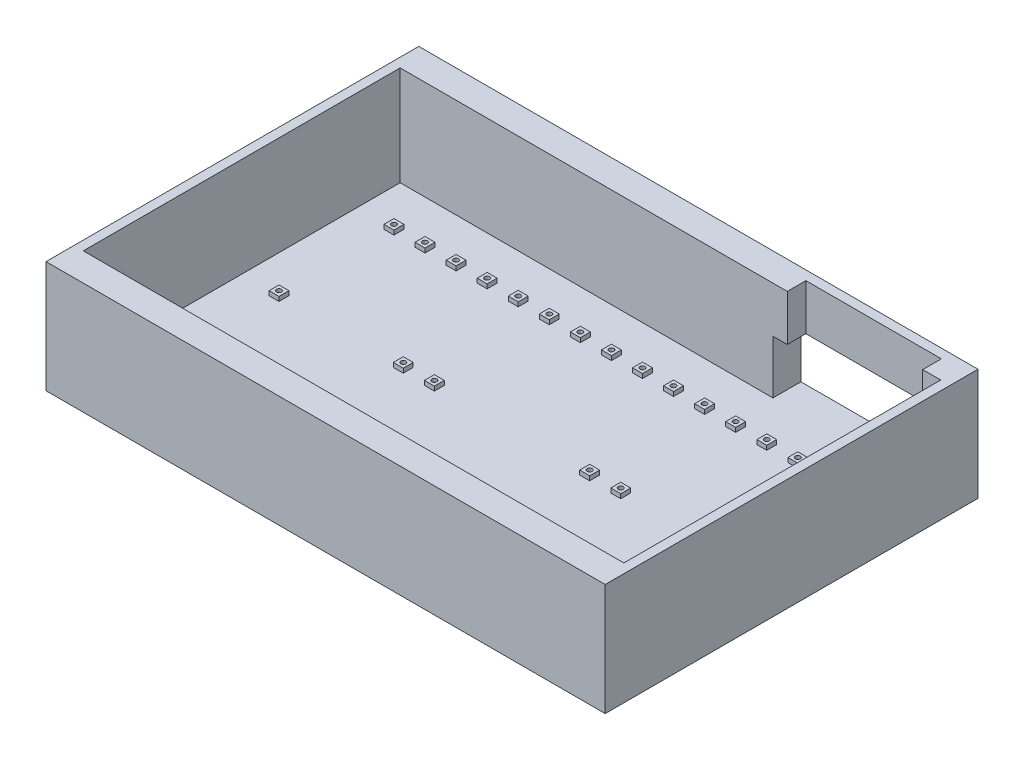
from build123d import *

# Parameters (mm, degrees)
SKETCH1_W           = 450
SKETCH1_H           = 300
BOSS_EXTRUDE1_DEPTH = 90
SKETCH2_W           = 435
SKETCH2_H           = 255
CUT_EXTRUDE1_DEPTH  = 80
SKETCH3_W           = 8
SKETCH3_H           = 8
SKETCH3_R           = 2
BOSS_EXTRUDE2_DEPTH = 3.5
SKETCH5_W           = 109
SKETCH5_H           = 15
CUT_EXTRUDE2_DEPTH  = 80
SKETCH7_W           = 135
SKETCH7_H           = 43
CUT_EXTRUDE3_DEPTH  = 369.417222724


with BuildPart() as part:
    # Sketch1 → Boss-Extrude1 (new body)
    with BuildSketch(Plane(origin=(0, 0, 0), x_dir=(1, 0, 0), z_dir=(0, 1, 0))):
        Rectangle(SKETCH1_W, SKETCH1_H)
    extrude(amount=BOSS_EXTRUDE1_DEPTH)

    # Sketch2 → Cut-Extrude1 (cut)
    with BuildSketch(Plane(origin=(0, 90, 0), x_dir=(1, 0, 0), z_dir=(0, 1, 0))):
        Rectangle(SKETCH2_W, SKETCH2_H)
    extrude(amount=-CUT_EXTRUDE1_DEPTH, mode=Mode.SUBTRACT)

    # Sketch3 → Boss-Extrude2 (add)
    # profile 1 of 38: a face of its own
    with BuildSketch(Plane(origin=(0, 10, 0), x_dir=(1, 0, 0), z_dir=(0, 1, 0))):
        with Locations((-162.5, 92.5)):
            Rectangle(SKETCH3_W, SKETCH3_H)
        with Locations(Location((-162.5, 92.5, 0), (0, 0, 270))):
            Circle(SKETCH3_R, mode=Mode.SUBTRACT)
    # profile 2 of 38: a face of its own
    with BuildSketch(Plane(origin=(0, 10, 0), x_dir=(1, 0, 0), z_dir=(0, 1, 0))):
        with Locations((-187.5, 92.5)):
            Rectangle(SKETCH3_W, SKETCH3_H)
        with Locations(Location((-187.5, 92.5, 0), (0, 0, 270))):
            Circle(SKETCH3_R, mode=Mode.SUBTRACT)
    # profile 3 of 38: a face of its own
    with BuildSketch(Plane(origin=(0, 10, 0), x_dir=(1, 0, 0), z_dir=(0, 1, 0))):
        with Locations((-137.5, 92.5)):
            Rectangle(SKETCH3_W, SKETCH3_H)
        with Locations(Location((-137.5, 92.5, 0), (0, 0, 270))):
            Circle(SKETCH3_R, mode=Mode.SUBTRACT)
    # profile 4 of 38: a face of its own
    with BuildSketch(Plane(origin=(0, 10, 0), x_dir=(1, 0, 0), z_dir=(0, 1, 0))):
        with Locations((-112.5, 92.5)):
            Rectangle(SKETCH3_W, SKETCH3_H)
        with Locations(Location((-112.5, 92.5, 0), (0, 0, 270))):
            Circle(SKETCH3_R, mode=Mode.SUBTRACT)
    # profile 5 of 38: a face of its own
    with BuildSketch(Plane(origin=(0, 10, 0), x_dir=(1, 0, 0), z_dir=(0, 1, 0))):
        with Locations((-87.5, 92.5)):
            Rectangle(SKETCH3_W, SKETCH3_H)
        with Locations(Location((-87.5, 92.5, 0), (0, 0, 270))):
            Circle(SKETCH3_R, mode=Mode.SUBTRACT)
    # profile 6 of 38: a face of its own
    with BuildSketch(Plane(origin=(0, 10, 0), x_dir=(1, 0, 0), z_dir=(0, 1, 0))):
        with Locations((-62.5, 92.5)):
            Rectangle(SKETCH3_W, SKETCH3_H)
        with Locations(Location((-62.5, 92.5, 0), (0, 0, 270))):
            Circle(SKETCH3_R, mode=Mode.SUBTRACT)
    # profile 7 of 38: a face of its own
    with BuildSketch(Plane(origin=(0, 10, 0), x_dir=(1, 0, 0), z_dir=(0, 1, 0))):
        with Locations((-37.5, 92.5)):
            Rectangle(SKETCH3_W, SKETCH3_H)
        with Locations(Location((-37.5, 92.5, 0), (0, 0, 270))):
            Circle(SKETCH3_R, mode=Mode.SUBTRACT)
    # profile 8 of 38: a face of its own
    with BuildSketch(Plane(origin=(0, 10, 0), x_dir=(1, 0, 0), z_dir=(0, 1, 0))):
        with Locations((-12.5, 92.5)):
            Rectangle(SKETCH3_W, SKETCH3_H)
        with Locations(Location((-12.5, 92.5, 0), (0, 0, 270))):
            Circle(SKETCH3_R, mode=Mode.SUBTRACT)
    # profile 9 of 38: a face of its own
    with BuildSketch(Plane(origin=(0, 10, 0), x_dir=(1, 0, 0), z_dir=(0, 1, 0))):
        with Locations((12.5, 92.5)):
            Rectangle(SKETCH3_W, SKETCH3_H)
        with Locations(Location((12.5, 92.5, 0), (0, 0, 270))):
            Circle(SKETCH3_R, mode=Mode.SUBTRACT)
    # profile 10 of 38: a face of its own
    with BuildSketch(Plane(origin=(0, 10, 0), x_dir=(1, 0, 0), z_dir=(0, 1, 0))):
        with Locations((37.5, 92.5)):
            Rectangle(SKETCH3_W, SKETCH3_H)
        with Locations(Location((37.5, 92.5, 0), (0, 0, 270))):
            Circle(SKETCH3_R, mode=Mode.SUBTRACT)
    # profile 11 of 38: a face of its own
    with BuildSketch(Plane(origin=(0, 10, 0), x_dir=(1, 0, 0), z_dir=(0, 1, 0))):
        with Locations((62.5, 92.5)):
            Rectangle(SKETCH3_W, SKETCH3_H)
        with Locations(Location((62.5, 92.5, 0), (0, 0, 270))):
            Circle(SKETCH3_R, mode=Mode.SUBTRACT)
    # profile 12 of 38: a face of its own
    with BuildSketch(Plane(origin=(0, 10, 0), x_dir=(1, 0, 0), z_dir=(0, 1, 0))):
        with Locations((87.5, 92.5)):
            Rectangle(SKETCH3_W, SKETCH3_H)
        with Locations(Location((87.5, 92.5, 0), (0, 0, 270))):
            Circle(SKETCH3_R, mode=Mode.SUBTRACT)
    # profile 13 of 38: a face of its own
    with BuildSketch(Plane(origin=(0, 10, 0), x_dir=(1, 0, 0), z_dir=(0, 1, 0))):
        with Locations((112.5, 92.5)):
            Rectangle(SKETCH3_W, SKETCH3_H)
        with Locations(Location((112.5, 92.5, 0), (0, 0, 270))):
            Circle(SKETCH3_R, mode=Mode.SUBTRACT)
    # profile 14 of 38: a face of its own
    with BuildSketch(Plane(origin=(0, 10, 0), x_dir=(1, 0, 0), z_dir=(0, 1, 0))):
        with Locations((137.5, 92.5)):
            Rectangle(SKETCH3_W, SKETCH3_H)
        with Locations(Location((137.5, 92.5, 0), (0, 0, 270))):
            Circle(SKETCH3_R, mode=Mode.SUBTRACT)
    # profile 15 of 38: a face of its own
    with BuildSketch(Plane(origin=(0, 10, 0), x_dir=(1, 0, 0), z_dir=(0, 1, 0))):
        with Locations((162.5, 92.5)):
            Rectangle(SKETCH3_W, SKETCH3_H)
        with Locations(Location((162.5, 92.5, 0), (0, 0, 270))):
            Circle(SKETCH3_R, mode=Mode.SUBTRACT)
    # profile 16 of 38: a face of its own
    with BuildSketch(Plane(origin=(0, 10, 0), x_dir=(1, 0, 0), z_dir=(0, 1, 0))):
        with Locations((187.5, 92.5)):
            Rectangle(SKETCH3_W, SKETCH3_H)
        with Locations(Location((187.5, 92.5, 0), (0, 0, 270))):
            Circle(SKETCH3_R, mode=Mode.SUBTRACT)
    # profile 17 of 38: a face of its own
    with BuildSketch(Plane(origin=(0, 10, 0), x_dir=(1, 0, 0), z_dir=(0, 1, 0))):
        with Locations((187.5, -92.5)):
            Rectangle(SKETCH3_W, SKETCH3_H)
        with Locations(Location((187.5, -92.5, 0), (0, 0, 90))):
            Circle(SKETCH3_R, mode=Mode.SUBTRACT)
    # profile 18 of 38: a face of its own
    with BuildSketch(Plane(origin=(0, 10, 0), x_dir=(1, 0, 0), z_dir=(0, 1, 0))):
        with Locations((162.5, -92.5)):
            Rectangle(SKETCH3_W, SKETCH3_H)
        with Locations(Location((162.5, -92.5, 0), (0, 0, 90))):
            Circle(SKETCH3_R, mode=Mode.SUBTRACT)
    # profile 19 of 38: a face of its own
    with BuildSketch(Plane(origin=(0, 10, 0), x_dir=(1, 0, 0), z_dir=(0, 1, 0))):
        with Locations((137.5, -92.5)):
            Rectangle(SKETCH3_W, SKETCH3_H)
        with Locations(Location((137.5, -92.5, 0), (0, 0, 90))):
            Circle(SKETCH3_R, mode=Mode.SUBTRACT)
    # profile 20 of 38: a face of its own
    with BuildSketch(Plane(origin=(0, 10, 0), x_dir=(1, 0, 0), z_dir=(0, 1, 0))):
        with Locations((112.5, -92.5)):
            Rectangle(SKETCH3_W, SKETCH3_H)
        with Locations(Location((112.5, -92.5, 0), (0, 0, 90))):
            Circle(SKETCH3_R, mode=Mode.SUBTRACT)
    # profile 21 of 38: a face of its own
    with BuildSketch(Plane(origin=(0, 10, 0), x_dir=(1, 0, 0), z_dir=(0, 1, 0))):
        with Locations((87.5, -92.5)):
            Rectangle(SKETCH3_W, SKETCH3_H)
        with Locations(Location((87.5, -92.5, 0), (0, 0, 90))):
            Circle(SKETCH3_R, mode=Mode.SUBTRACT)
    # profile 22 of 38: a face of its own
    with BuildSketch(Plane(origin=(0, 10, 0), x_dir=(1, 0, 0), z_dir=(0, 1, 0))):
        with Locations((62.5, -92.5)):
            Rectangle(SKETCH3_W, SKETCH3_H)
        with Locations(Location((62.5, -92.5, 0), (0, 0, 90))):
            Circle(SKETCH3_R, mode=Mode.SUBTRACT)
    # profile 23 of 38: a face of its own
    with BuildSketch(Plane(origin=(0, 10, 0), x_dir=(1, 0, 0), z_dir=(0, 1, 0))):
        with Locations((37.5, -92.5)):
            Rectangle(SKETCH3_W, SKETCH3_H)
        with Locations(Location((37.5, -92.5, 0), (0, 0, 90))):
            Circle(SKETCH3_R, mode=Mode.SUBTRACT)
    # profile 24 of 38: a face of its own
    with BuildSketch(Plane(origin=(0, 10, 0), x_dir=(1, 0, 0), z_dir=(0, 1, 0))):
        with Locations((12.5, -92.5)):
            Rectangle(SKETCH3_W, SKETCH3_H)
        with Locations(Location((12.5, -92.5, 0), (0, 0, 90))):
            Circle(SKETCH3_R, mode=Mode.SUBTRACT)
    # profile 25 of 38: a face of its own
    with BuildSketch(Plane(origin=(0, 10, 0), x_dir=(1, 0, 0), z_dir=(0, 1, 0))):
        with Locations((-12.5, -92.5)):
            Rectangle(SKETCH3_W, SKETCH3_H)
        with Locations(Location((-12.5, -92.5, 0), (0, 0, 90))):
            Circle(SKETCH3_R, mode=Mode.SUBTRACT)
    # profile 26 of 38: a face of its own
    with BuildSketch(Plane(origin=(0, 10, 0), x_dir=(1, 0, 0), z_dir=(0, 1, 0))):
        with Locations((-37.5, -92.5)):
            Rectangle(SKETCH3_W, SKETCH3_H)
        with Locations(Location((-37.5, -92.5, 0), (0, 0, 90))):
            Circle(SKETCH3_R, mode=Mode.SUBTRACT)
    # profile 27 of 38: a face of its own
    with BuildSketch(Plane(origin=(0, 10, 0), x_dir=(1, 0, 0), z_dir=(0, 1, 0))):
        with Locations((-62.5, -92.5)):
            Rectangle(SKETCH3_W, SKETCH3_H)
        with Locations(Location((-62.5, -92.5, 0), (0, 0, 90))):
            Circle(SKETCH3_R, mode=Mode.SUBTRACT)
    # profile 28 of 38: a face of its own
    with BuildSketch(Plane(origin=(0, 10, 0), x_dir=(1, 0, 0), z_dir=(0, 1, 0))):
        with Locations((-87.5, -92.5)):
            Rectangle(SKETCH3_W, SKETCH3_H)
        with Locations(Location((-87.5, -92.5, 0), (0, 0, 90))):
            Circle(SKETCH3_R, mode=Mode.SUBTRACT)
    # profile 29 of 38: a face of its own
    with BuildSketch(Plane(origin=(0, 10, 0), x_dir=(1, 0, 0), z_dir=(0, 1, 0))):
        with Locations((-112.5, -92.5)):
            Rectangle(SKETCH3_W, SKETCH3_H)
        with Locations(Location((-112.5, -92.5, 0), (0, 0, 90))):
            Circle(SKETCH3_R, mode=Mode.SUBTRACT)
    # profile 30 of 38: a face of its own
    with BuildSketch(Plane(origin=(0, 10, 0), x_dir=(1, 0, 0), z_dir=(0, 1, 0))):
        with Locations((-137.5, -92.5)):
            Rectangle(SKETCH3_W, SKETCH3_H)
        with Locations(Location((-137.5, -92.5, 0), (0, 0, 90))):
            Circle(SKETCH3_R, mode=Mode.SUBTRACT)
    # profile 31 of 38: a face of its own
    with BuildSketch(Plane(origin=(0, 10, 0), x_dir=(1, 0, 0), z_dir=(0, 1, 0))):
        with Locations((-162.5, -92.5)):
            Rectangle(SKETCH3_W, SKETCH3_H)
        with Locations(Location((-162.5, -92.5, 0), (0, 0, 90))):
            Circle(SKETCH3_R, mode=Mode.SUBTRACT)
    # profile 32 of 38: a face of its own
    with BuildSketch(Plane(origin=(0, 10, 0), x_dir=(1, 0, 0), z_dir=(0, 1, 0))):
        with Locations((-187.5, -92.5)):
            Rectangle(SKETCH3_W, SKETCH3_H)
        with Locations(Location((-187.5, -92.5, 0), (0, 0, 90))):
            Circle(SKETCH3_R, mode=Mode.SUBTRACT)
    # profile 33 of 38: a face of its own
    with BuildSketch(Plane(origin=(0, 10, 0), x_dir=(1, 0, 0), z_dir=(0, 1, 0))):
        with Locations((-187.5, 0)):
            Rectangle(SKETCH3_W, SKETCH3_H)
        with Locations(Location((-187.5, 0, 0), (0, 0, 270))):
            Circle(SKETCH3_R, mode=Mode.SUBTRACT)
    # profile 34 of 38: a face of its own
    with BuildSketch(Plane(origin=(0, 10, 0), x_dir=(1, 0, 0), z_dir=(0, 1, 0))):
        with Locations((-87.5, 0)):
            Rectangle(SKETCH3_W, SKETCH3_H)
        with Locations(Location((-87.5, 0, 0), (0, 0, 270))):
            Circle(SKETCH3_R, mode=Mode.SUBTRACT)
    # profile 35 of 38: a face of its own
    with BuildSketch(Plane(origin=(0, 10, 0), x_dir=(1, 0, 0), z_dir=(0, 1, 0))):
        with Locations((-62.5, 0)):
            Rectangle(SKETCH3_W, SKETCH3_H)
        with Locations(Location((-62.5, 0, 0), (0, 0, 270))):
            Circle(SKETCH3_R, mode=Mode.SUBTRACT)
    # profile 36 of 38: a face of its own
    with BuildSketch(Plane(origin=(0, 10, 0), x_dir=(1, 0, 0), z_dir=(0, 1, 0))):
        with Locations((62.5, 0)):
            Rectangle(SKETCH3_W, SKETCH3_H)
        with Locations(Location((62.5, 0, 0), (0, 0, 90))):
            Circle(SKETCH3_R, mode=Mode.SUBTRACT)
    # profile 37 of 38: a face of its own
    with BuildSketch(Plane(origin=(0, 10, 0), x_dir=(1, 0, 0), z_dir=(0, 1, 0))):
        with Locations((87.5, 0)):
            Rectangle(SKETCH3_W, SKETCH3_H)
        with Locations(Location((87.5, 0, 0), (0, 0, 90))):
            Circle(SKETCH3_R, mode=Mode.SUBTRACT)
    # profile 38 of 38: a face of its own
    with BuildSketch(Plane(origin=(0, 10, 0), x_dir=(1, 0, 0), z_dir=(0, 1, 0))):
        with Locations((187.5, 0)):
            Rectangle(SKETCH3_W, SKETCH3_H)
        with Locations(Location((187.5, 0, 0), (0, 0, 90))):
            Circle(SKETCH3_R, mode=Mode.SUBTRACT)
    extrude(amount=BOSS_EXTRUDE2_DEPTH)

    # Sketch5 → Cut-Extrude2 (cut)
    with BuildSketch(Plane(origin=(0, 90, 0), x_dir=(1, 0, 0), z_dir=(0, 1, 0))):
        with Locations((148.5, 135)):
            Rectangle(SKETCH5_W, SKETCH5_H)
    extrude(amount=-CUT_EXTRUDE2_DEPTH, mode=Mode.SUBTRACT)

    # Sketch7 → Cut-Extrude3 (cut, through all)
    with BuildSketch(Plane.XY.offset(-127.5)):
        with Locations((150, 31.5)):
            Rectangle(SKETCH7_W, SKETCH7_H)
    extrude(amount=-CUT_EXTRUDE3_DEPTH, mode=Mode.SUBTRACT)


solid = part.part
